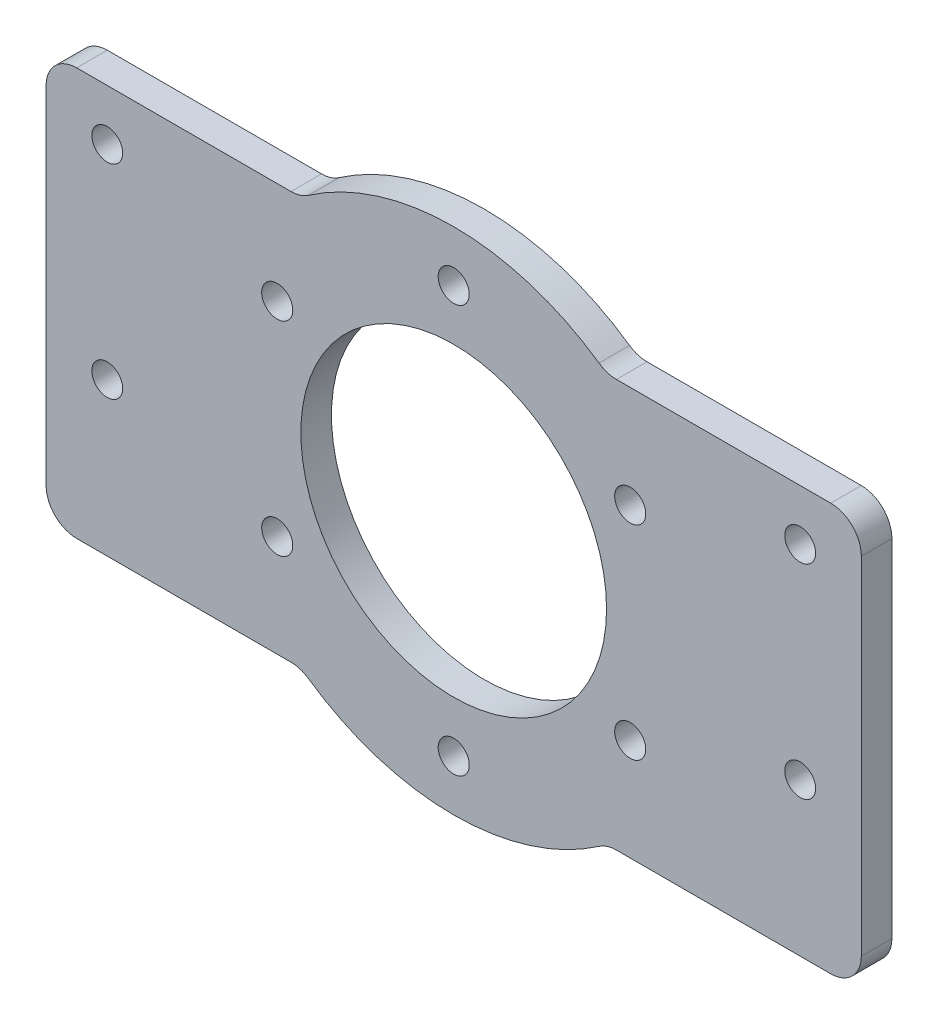
from build123d import *

# Parameters (mm, degrees)
SKETCH_1_R          = 25
SKETCH_1_R_2        = 1.525
SKETCH_1_R_3        = 15
EXTRUDE_1_DEPTH     = 3
EXTRUDE_START       = -3
EXTRUDE_2_DEPTH     = 3
FILLET_1_R          = 3
SKETCH_4_R          = 1.515
CUT_EXTRUDE_1_DEPTH = 10


with BuildPart() as part:
    # 草图1 → 凸台-拉伸1 (new body)
    with BuildSketch(Plane.XY):
        Circle(SKETCH_1_R)
        with Locations((0, 20)):
            Circle(SKETCH_1_R_2, mode=Mode.SUBTRACT)
        with Locations((17.320508076, 10)):
            Circle(SKETCH_1_R_2, mode=Mode.SUBTRACT)
        with Locations((17.320508076, -10)):
            Circle(SKETCH_1_R_2, mode=Mode.SUBTRACT)
        with Locations((0, -20)):
            Circle(SKETCH_1_R_2, mode=Mode.SUBTRACT)
        with Locations((-17.320508076, -10)):
            Circle(SKETCH_1_R_2, mode=Mode.SUBTRACT)
        with Locations((-17.320508076, 10)):
            Circle(SKETCH_1_R_2, mode=Mode.SUBTRACT)
        Circle(SKETCH_1_R_3, mode=Mode.SUBTRACT)
    extrude(amount=EXTRUDE_1_DEPTH)

    # 草图3 → 凸台-拉伸2 (add)
    with BuildSketch(Plane.XY.offset(3).offset(EXTRUDE_START)):
        with BuildLine():
            Line((15, 20), (40, 20))
            Line((40, 20), (40, -20))
            Line((40, -20), (15, -20))
            ThreePointArc((15, -20), (25, 0), (15, 20))
        make_face()
        with BuildLine():
            Line((-40, -20), (-15, -20))
            ThreePointArc((-15, -20), (-25, 0), (-15, 20))
            Line((-15, 20), (-40, 20))
            Line((-40, 20), (-40, -20))
        make_face()
    extrude(amount=EXTRUDE_2_DEPTH)

    # 圆角1
    fillet_1_edges = [part.edges().sort_by_distance(p)[0] for p in [
        (40, 20, 1.5),
        (40, -20, 1.5),
        (15, -20, 1.5),
        (15, 20, 1.5),
        (-40, -20, 1.5),
        (-40, 20, 1.5),
        (-15, 20, 1.5),
        (-15, -20, 1.5),
    ]]
    fillet(fillet_1_edges, radius=FILLET_1_R)

    # 草图4 → 切除-拉伸1 (cut)
    with BuildSketch(Plane.XY.offset(3)):
        with Locations((-34, 15)):
            Circle(SKETCH_4_R)
        with Locations((-34, -5)):
            Circle(SKETCH_4_R)
        with Locations((34, -5)):
            Circle(SKETCH_4_R)
        with Locations((34, 15)):
            Circle(SKETCH_4_R)
    extrude(amount=-CUT_EXTRUDE_1_DEPTH, mode=Mode.SUBTRACT)


solid = part.part
